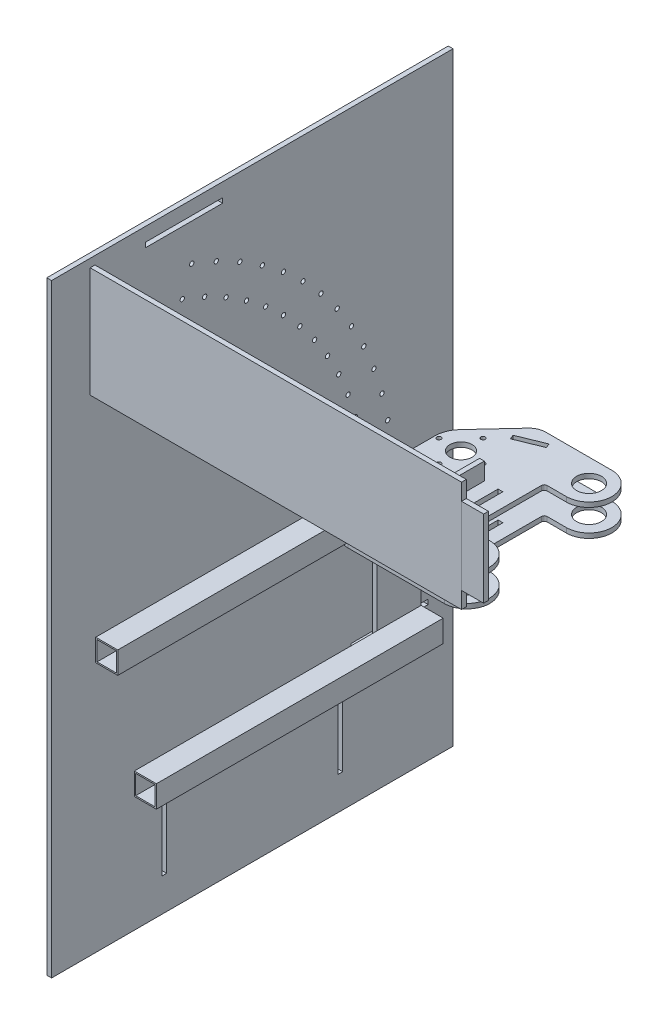
from build123d import *

# Parameters (mm, degrees)
CROQUIS3_R                   = 2.4892
CROQUIS3_R_2                 = 12.7
CROQUIS3_R_3                 = 26.19375
CROQUIS3_R_4                 = 14.2875
SALIENTE_EXTRUIR1_DEPTH      = 5.5
SALIENTE_EXTRUIR2_START      = -25.4
CROQUIS4_R                   = 14.2875
SALIENTE_EXTRUIR2_DEPTH      = 5.5
SALIENTE_EXTRUIR5_DEPTH      = 330.2
SALIENTE_EXTRUIR5_DEPTH_BACK = 30.325
CROQUIS7_W                   = 25.4
CROQUIS7_H                   = 25.4
CROQUIS7_W_2                 = 22.225
CROQUIS7_H_2                 = 22.225
SALIENTE_EXTRUIR6_START      = -80.264
CROQUIS8_W                   = 25.4
CROQUIS8_H                   = 265.106252616
CROQUIS8_H_2                 = 65.093747384
SALIENTE_EXTRUIR6_DEPTH      = 25.4
VACIADO1_T                   = -1.5875
CROQUIS9_W                   = 5.5
CROQUIS9_H                   = 31.75
CORTAR_EXTRUIR1_DEPTH        = 5.5
SALIENTE_EXTRUIR7_START      = -5.5
CROQUIS9_3_W                 = 5.5
CROQUIS9_3_H                 = 31.75
SALIENTE_EXTRUIR7_DEPTH      = 19.05
SALIENTE_EXTRUIR8_START      = -5.5
CROQUIS9_4_W                 = 5.5
CROQUIS9_4_H                 = 9.525
CROQUIS9_4_H_2               = 31.75
SALIENTE_EXTRUIR8_DEPTH      = 105.664
CROQUIS10_W                  = 5.5
CROQUIS10_H                  = 31.75
CORTAR_EXTRUIR2_DEPTH        = 125.476
REDONDEO1_R                  = 2.54
SALIENTE_EXTRUIR9_START      = 5.5
CROQUIS10_4_W                = 5.5
CROQUIS10_4_H                = 31.75
SALIENTE_EXTRUIR9_DEPTH      = 25.4
SALIENTE_EXTRUIR10_START     = 5.5
CROQUIS10_5_W                = 5.5
CROQUIS10_5_H                = 50.8
SALIENTE_EXTRUIR10_DEPTH     = 25.4
SALIENTE_EXTRUIR11_START     = 30.9
CROQUIS10_7_W                = 5.5
CROQUIS10_7_H                = 31.75
SALIENTE_EXTRUIR11_DEPTH     = 25.4
CROQUIS11_W                  = 462.125
CROQUIS11_H                  = 695.364
CROQUIS11_R                  = 2.4892
SALIENTE_EXTRUIR15_DEPTH     = 5.5
CROQUIS13_W                  = 5.5
CROQUIS13_H                  = 88.9
CROQUIS13_W_2                = 88.9
CROQUIS13_H_2                = 5.5
CORTAR_EXTRUIR4_DEPTH        = 5.5
SALIENTE_EXTRUIR16_START     = -5.5
CROQUIS13_3_W                = 5.5
CROQUIS13_3_H                = 88.9
SALIENTE_EXTRUIR16_DEPTH     = 25.4
SALIENTE_EXTRUIR17_START     = -5.5
CROQUIS13_5_W                = 5.5
CROQUIS13_5_H                = 127
SALIENTE_EXTRUIR17_DEPTH     = 427.482
SALIENTE_EXTRUIR18_START     = -432.982
CROQUIS13_6_W                = 5.5
CROQUIS13_6_H                = 88.9
SALIENTE_EXTRUIR18_DEPTH     = 25.4
CROQUIS14_R                  = 2.4892
CORTAR_EXTRUIR5_DEPTH        = 590.160895234


with BuildPart() as part:
    # Croquis3 → Saliente-Extruir1 (new body)
    # profile 1 of 4: a face of its own
    with BuildSketch(Plane(origin=(0, 0, 0), x_dir=(1, 0, 0), z_dir=(0, 1, 0))):
        with BuildLine():
            ThreePointArc((-69.85, 75.40625), (-96.04375, 101.6), (-69.85, 127.79375))
            Line((-69.85, 127.79375), (-146.05, 127.79375))
            ThreePointArc((-146.05, 127.79375), (-153.672023606, 126.202480084), (-160.020693211, 121.6945118))
            Line((-160.020693211, 121.6945118), (-198.003950242, 80.719900472))
            ThreePointArc((-198.003950242, 80.719900472), (-165.049154863, 88.253773247), (-146.002858571, 60.325))
            ThreePointArc((-146.002858571, 60.325), (-176.002858571, 30.325), (-206.002858571, 60.325))
            Line((-206.002858571, 60.325), (-206.002858571, -39.693747384))
            ThreePointArc((-206.002858571, -39.693747384), (-198.563370813, -57.654259626), (-180.602858571, -65.093747384))
            Line((-180.602858571, -65.093747384), (-69.85, -65.093747384))
            ThreePointArc((-69.85, -65.093747384), (-96.04375, -38.899997384), (-69.85, -12.706247384))
            Line((-69.85, -12.706247384), (-92.075, -12.706247384))
            ThreePointArc((-92.075, -12.706247384), (-94.32006403, -11.776311414), (-95.25, -9.531247384))
            Line((-95.25, -9.531247384), (-95.25, 72.23125))
            ThreePointArc((-95.25, 72.23125), (-94.32006403, 74.47631403), (-92.075, 75.40625))
            Line((-92.075, 75.40625), (-69.85, 75.40625))
        make_face()
    # profile 2 of 4: a face of its own
    with BuildSketch(Plane(origin=(0, 0, 0), x_dir=(1, 0, 0), z_dir=(0, 1, 0))):
        with BuildLine():
            ThreePointArc((-146.002858571, 60.325), (-165.049154863, 88.253773247), (-198.003950242, 80.719900472))
            ThreePointArc((-198.003950242, 80.719900472), (-203.931631818, 71.278703708), (-206.002858571, 60.325))
            ThreePointArc((-206.002858571, 60.325), (-176.002858571, 30.325), (-146.002858571, 60.325))
        make_face()
        with Locations(Location((-176.002858571, 34.925, 0), (0, 0, 270))):
            Circle(CROQUIS3_R, mode=Mode.SUBTRACT)
        with Locations(Location((-201.402858571, 60.325, 0), (0, 0, 270))):
            Circle(CROQUIS3_R, mode=Mode.SUBTRACT)
        with Locations(Location((-176.002858571, 60.325, 0), (0, 0, 270))):
            Circle(CROQUIS3_R_2, mode=Mode.SUBTRACT)
        with Locations(Location((-150.602858571, 60.325, 0), (0, 0, 270))):
            Circle(CROQUIS3_R, mode=Mode.SUBTRACT)
        with Locations(Location((-176.002858571, 85.725, 0), (0, 0, 270))):
            Circle(CROQUIS3_R, mode=Mode.SUBTRACT)
    # profile 3 of 4: a face of its own
    with BuildSketch(Plane(origin=(0, 0, 0), x_dir=(1, 0, 0), z_dir=(0, 1, 0))):
        with Locations((-69.85, 101.6)):
            Circle(CROQUIS3_R_3)
        with Locations(Location((-69.85, 101.6, 0), (0, 0, 270))):
            Circle(CROQUIS3_R_4, mode=Mode.SUBTRACT)
    # profile 4 of 4: a face of its own
    with BuildSketch(Plane(origin=(0, 0, 0), x_dir=(1, 0, 0), z_dir=(0, 1, 0))):
        with Locations((-69.85, -38.899997384)):
            Circle(CROQUIS3_R_3)
        with Locations(Location((-69.85, -38.899997384, 0), (0, 0, 270))):
            Circle(CROQUIS3_R_4, mode=Mode.SUBTRACT)
    extrude(amount=SALIENTE_EXTRUIR1_DEPTH)


with BuildPart() as body_2:
    # Croquis4 → Saliente-Extruir2 (new body)
    with BuildSketch(Plane(origin=(0, 0, 0), x_dir=(1, 0, 0), z_dir=(0, 1, 0)).offset(SALIENTE_EXTRUIR2_START)):
        with BuildLine():
            ThreePointArc((-146.002858571, 60.325), (-154.789655135, 39.111796564), (-176.002858571, 30.325))
            Line((-176.002858571, 30.325), (-199.652858571, 30.325))
            ThreePointArc((-199.652858571, 30.325), (-204.142986631, 28.465128061), (-206.002858571, 23.975))
            Line((-206.002858571, 23.975), (-206.002858571, -39.693747384))
            ThreePointArc((-206.002858571, -39.693747384), (-198.563370813, -57.654259626), (-180.602858571, -65.093747384))
            Line((-180.602858571, -65.093747384), (-69.85, -65.093747384))
            ThreePointArc((-69.85, -65.093747384), (-43.65625, -38.899997384), (-69.85, -12.706247384))
            Line((-69.85, -12.706247384), (-92.075, -12.706247384))
            ThreePointArc((-92.075, -12.706247384), (-94.32006403, -11.776311414), (-95.25, -9.531247384))
            Line((-95.25, -9.531247384), (-95.25, 72.23125))
            ThreePointArc((-95.25, 72.23125), (-94.32006403, 74.47631403), (-92.075, 75.40625))
            Line((-92.075, 75.40625), (-69.85, 75.40625))
            ThreePointArc((-69.85, 75.40625), (-43.65625, 101.6), (-69.85, 127.79375))
            Line((-69.85, 127.79375), (-146.05, 127.79375))
            ThreePointArc((-146.05, 127.79375), (-153.672023606, 126.202480084), (-160.020693211, 121.6945118))
            Line((-160.020693211, 121.6945118), (-198.003950242, 80.719900472))
            ThreePointArc((-198.003950242, 80.719900472), (-165.049154863, 88.253773247), (-146.002858571, 60.325))
        make_face()
        with Locations(Location((-69.85, -38.899997384, 0), (0, 0, 90))):
            Circle(CROQUIS4_R, mode=Mode.SUBTRACT)
        with Locations(Location((-69.85, 101.6, 0), (0, 0, 90))):
            Circle(CROQUIS4_R, mode=Mode.SUBTRACT)
    extrude(amount=-SALIENTE_EXTRUIR2_DEPTH)

    # Croquis9 → Cortar-Extruir1 (cut)
    with BuildSketch(Plane(origin=(0, -25.4, 0), x_dir=(1, 0, 0), z_dir=(0, 1, 0))):
        with Locations((-164.302858571, -25.4)):
            Rectangle(CROQUIS9_W, CROQUIS9_H)
        with Locations((-133.402858571, -25.4)):
            Rectangle(CROQUIS9_W, CROQUIS9_H)
    extrude(amount=-CORTAR_EXTRUIR1_DEPTH, mode=Mode.SUBTRACT)


with BuildPart() as body_3:
    # Croquis7 → Saliente-Extruir5 (new, two sides: drawn at the far end of the back side and taken through both)
    with BuildSketch(Plane.XY.offset(-SALIENTE_EXTRUIR5_DEPTH_BACK)):
        with Locations((-193.302858571, -12.7)):
            Rectangle(CROQUIS7_W, CROQUIS7_H)
        with Locations((-193.302858571, -12.7)):
            Rectangle(CROQUIS7_W_2, CROQUIS7_H_2, mode=Mode.SUBTRACT)
    extrude(amount=SALIENTE_EXTRUIR5_DEPTH + SALIENTE_EXTRUIR5_DEPTH_BACK)


with BuildPart() as body_4:
    # Croquis8 → Saliente-Extruir6 (new body)
    with BuildSketch(Plane(origin=(0, -30.9, 0), x_dir=(1, 0, 0), z_dir=(0, 1, 0)).offset(SALIENTE_EXTRUIR6_START)):
        with Locations((-148.852858571, -197.646873692)):
            Rectangle(CROQUIS8_W, CROQUIS8_H)
        with Locations((-148.852858571, -32.546873692)):
            Rectangle(CROQUIS8_W, CROQUIS8_H_2)
    extrude(amount=-SALIENTE_EXTRUIR6_DEPTH)

    # Vaciado1
    vaciado1_openings = [body_4.faces().sort_by_distance(p)[0] for p in [
        (-148.852858571, -123.864, 330.2),
        (-148.852858571, -123.864, 0),
    ]]
    offset(amount=VACIADO1_T, openings=vaciado1_openings, kind=Kind.INTERSECTION)


with BuildPart() as body_5:
    # Croquis9<3> → Saliente-Extruir7 (new body)
    with BuildSketch(Plane(origin=(0, -25.4, 0), x_dir=(1, 0, 0), z_dir=(0, 1, 0)).offset(SALIENTE_EXTRUIR7_START)):
        with Locations((-164.302858571, -25.4)):
            Rectangle(CROQUIS9_3_W, CROQUIS9_3_H)
    extrude(amount=SALIENTE_EXTRUIR7_DEPTH)


with BuildPart() as body_6:
    # Croquis9<4> → Saliente-Extruir8 (new body)
    with BuildSketch(Plane(origin=(0, -25.4, 0), x_dir=(1, 0, 0), z_dir=(0, 1, 0)).offset(SALIENTE_EXTRUIR8_START)):
        with Locations((-164.302858571, -46.0375)):
            Rectangle(CROQUIS9_4_W, CROQUIS9_4_H)
        with Locations((-164.302858571, -25.4)):
            Rectangle(CROQUIS9_4_W, CROQUIS9_4_H_2)
        with Locations((-164.302858571, -4.7625)):
            Rectangle(CROQUIS9_4_W, CROQUIS9_4_H)
    extrude(amount=-SALIENTE_EXTRUIR8_DEPTH)


with BuildPart() as cortar_extruir2_tool:
    # Croquis10 → Cortar-Extruir2 (new body)
    with BuildSketch(Plane(origin=(0, -30.9, 0), x_dir=(1, 0, 0), z_dir=(0, 1, 0))):
        Polygon((-132.265114716, 117.849490196), (-161.667858629, 105.868624183), (-159.59243302, 100.775235474), (-130.189689108, 112.756101487), align=None)
        with Locations((-135.25, 27.78125)):
            Rectangle(CROQUIS10_W, CROQUIS10_H)
        with Locations((-113.875, 27.78125)):
            Rectangle(CROQUIS10_W, CROQUIS10_H)
        with Locations((-148.852858571, -25.4)):
            Rectangle(CROQUIS10_W, CROQUIS10_H)
    extrude(amount=CORTAR_EXTRUIR2_DEPTH)


with BuildPart() as part_1:
    add(part.part)

    # Cortar-Extruir2: cut by cortar_extruir2_tool
    add(cortar_extruir2_tool.part, mode=Mode.SUBTRACT)


with BuildPart() as body_2_1:
    add(body_2.part)

    # Cortar-Extruir2: cut by cortar_extruir2_tool
    add(cortar_extruir2_tool.part, mode=Mode.SUBTRACT)

    # Redondeo1
    redondeo1_edges = [body_2_1.edges().sort_by_distance(p)[0] for p in [
        (-198.003950242, -28.15, -80.719900472),
    ]]
    fillet(redondeo1_edges, radius=REDONDEO1_R)


with BuildPart() as body_7:
    # Croquis10<4> → Saliente-Extruir9 (new body)
    with BuildSketch(Plane(origin=(0, -30.9, 0), x_dir=(1, 0, 0), z_dir=(0, 1, 0)).offset(SALIENTE_EXTRUIR9_START)):
        with Locations((-135.25, 27.78125)):
            Rectangle(CROQUIS10_4_W, CROQUIS10_4_H)
    extrude(amount=-SALIENTE_EXTRUIR9_DEPTH)


with BuildPart() as body_8:
    # Croquis10<5> → Saliente-Extruir10 (new body)
    with BuildSketch(Plane(origin=(0, -30.9, 0), x_dir=(1, 0, 0), z_dir=(0, 1, 0)).offset(SALIENTE_EXTRUIR10_START)):
        with Locations((-135.25, 27.78125)):
            Rectangle(CROQUIS10_5_W, CROQUIS10_5_H)
    extrude(amount=SALIENTE_EXTRUIR10_DEPTH)


with BuildPart() as body_9:
    # Croquis10<7> → Saliente-Extruir11 (new body)
    with BuildSketch(Plane(origin=(0, -30.9, 0), x_dir=(1, 0, 0), z_dir=(0, 1, 0)).offset(SALIENTE_EXTRUIR11_START)):
        with Locations((-135.25, 27.78125)):
            Rectangle(CROQUIS10_7_W, CROQUIS10_7_H)
    extrude(amount=SALIENTE_EXTRUIR11_DEPTH)


with BuildPart() as body_10:
    # Croquis11 → Saliente-Extruir15 (new body)
    with BuildSketch(Plane.ZY.offset(206.002858571)):
        with Locations((149.9375, 33.318)):
            Rectangle(CROQUIS11_W, CROQUIS11_H)
        with Locations((-11.275, -12.7)):
            Circle(CROQUIS11_R, mode=Mode.SUBTRACT)
        with Locations((20.475, -12.7)):
            Circle(CROQUIS11_R, mode=Mode.SUBTRACT)
        with Locations((298.45, -12.7)):
            Circle(CROQUIS11_R, mode=Mode.SUBTRACT)
        with Locations((-9.93933903, 17.891665704)):
            Circle(CROQUIS11_R, mode=Mode.SUBTRACT)
        with Locations((21.689842634, 15.124470872)):
            Circle(CROQUIS11_R, mode=Mode.SUBTRACT)
        with Locations((-5.942521307, 48.250510361)):
            Circle(CROQUIS11_R, mode=Mode.SUBTRACT)
        with Locations((25.325124851, 42.73718072)):
            Circle(CROQUIS11_R, mode=Mode.SUBTRACT)
        with Locations((0.685034973, 78.145484831)):
            Circle(CROQUIS11_R, mode=Mode.SUBTRACT)
        with Locations((31.353179957, 69.927980149)):
            Circle(CROQUIS11_R, mode=Mode.SUBTRACT)
        with Locations((9.892890104, 107.349070307)):
            Circle(CROQUIS11_R, mode=Mode.SUBTRACT)
        with Locations((39.728130814, 96.489930757)):
            Circle(CROQUIS11_R, mode=Mode.SUBTRACT)
        with Locations((21.61096675, 135.639009871)):
            Circle(CROQUIS11_R, mode=Mode.SUBTRACT)
        with Locations((50.386238989, 122.220880061)):
            Circle(CROQUIS11_R, mode=Mode.SUBTRACT)
        with Locations((35.750083272, 162.8)):
            Circle(CROQUIS11_R, mode=Mode.SUBTRACT)
        with Locations((63.246389842, 146.925)):
            Circle(CROQUIS11_R, mode=Mode.SUBTRACT)
        with Locations((52.202632455, 188.625329159)):
            Circle(CROQUIS11_R, mode=Mode.SUBTRACT)
        with Locations((78.210709861, 170.414277305)):
            Circle(CROQUIS11_R, mode=Mode.SUBTRACT)
        with Locations((70.843400465, 212.918451)):
            Circle(CROQUIS11_R, mode=Mode.SUBTRACT)
        with Locations((95.165311534, 192.509944392)):
            Circle(CROQUIS11_R, mode=Mode.SUBTRACT)
        with Locations((91.530519804, 235.494480196)):
            Circle(CROQUIS11_R, mode=Mode.SUBTRACT)
        with Locations((113.981160106, 213.043839894)):
            Circle(CROQUIS11_R, mode=Mode.SUBTRACT)
        with Locations((114.106549, 256.181599535)):
            Circle(CROQUIS11_R, mode=Mode.SUBTRACT)
        with Locations((134.515055608, 231.859688466)):
            Circle(CROQUIS11_R, mode=Mode.SUBTRACT)
        with Locations((138.399670841, 274.822367545)):
            Circle(CROQUIS11_R, mode=Mode.SUBTRACT)
        with Locations((156.610722695, 248.814290139)):
            Circle(CROQUIS11_R, mode=Mode.SUBTRACT)
        with Locations((164.225, 291.274916728)):
            Circle(CROQUIS11_R, mode=Mode.SUBTRACT)
        with Locations((180.1, 263.778610158)):
            Circle(CROQUIS11_R, mode=Mode.SUBTRACT)
        with Locations((191.385990129, 305.41403325)):
            Circle(CROQUIS11_R, mode=Mode.SUBTRACT)
        with Locations((204.804119939, 276.638761011)):
            Circle(CROQUIS11_R, mode=Mode.SUBTRACT)
        with Locations((219.675929693, 317.132109896)):
            Circle(CROQUIS11_R, mode=Mode.SUBTRACT)
        with Locations((230.535069243, 287.296869186)):
            Circle(CROQUIS11_R, mode=Mode.SUBTRACT)
    extrude(amount=SALIENTE_EXTRUIR15_DEPTH)

    # Croquis13 → Cortar-Extruir4 (cut)
    with BuildSketch(Plane.ZY.offset(211.502858571)):
        with Locations((333.8, 307.975)):
            Rectangle(CROQUIS13_W, CROQUIS13_H)
        with Locations((228.6, 362.375)):
            Rectangle(CROQUIS13_W_2, CROQUIS13_H_2)
        with Locations((251.25, -231.814)):
            Rectangle(CROQUIS13_W, CROQUIS13_H)
        with Locations((48.625, -231.814)):
            Rectangle(CROQUIS13_W, CROQUIS13_H)
        with Locations((-8.1, -156.039)):
            Rectangle(CROQUIS13_W_2, CROQUIS13_H_2)
    extrude(amount=-CORTAR_EXTRUIR4_DEPTH, mode=Mode.SUBTRACT)


with BuildPart() as body_11:
    # Croquis13<3> → Saliente-Extruir16 (new body)
    with BuildSketch(Plane.ZY.offset(211.502858571).offset(SALIENTE_EXTRUIR16_START)):
        with Locations((333.8, 307.975)):
            Rectangle(CROQUIS13_3_W, CROQUIS13_3_H)
    extrude(amount=SALIENTE_EXTRUIR16_DEPTH)


with BuildPart() as body_12:
    # Croquis13<5> → Saliente-Extruir17 (new body)
    with BuildSketch(Plane.ZY.offset(211.502858571).offset(SALIENTE_EXTRUIR17_START)):
        with Locations((333.8, 307.975)):
            Rectangle(CROQUIS13_5_W, CROQUIS13_5_H)
    extrude(amount=-SALIENTE_EXTRUIR17_DEPTH)


with BuildPart() as body_13:
    # Croquis13<6> → Saliente-Extruir18 (new body)
    with BuildSketch(Plane.ZY.offset(211.502858571).offset(SALIENTE_EXTRUIR18_START)):
        with Locations((333.8, 307.975)):
            Rectangle(CROQUIS13_6_W, CROQUIS13_6_H)
    extrude(amount=-SALIENTE_EXTRUIR18_DEPTH)


with BuildPart() as cortar_extruir5_tool:
    # Croquis14 → Cortar-Extruir5 (new, through all)
    with BuildSketch(Plane(origin=(0, 5.5, 0), x_dir=(1, 0, 0), z_dir=(0, 1, 0))):
        with Locations(Location((-193.302858571, -46.043747384, 0), (0, 0, 180))):
            Circle(CROQUIS14_R)
        with Locations(Location((-193.302858571, -33.343747384, 0), (0, 0, 180))):
            Circle(CROQUIS14_R)
        with Locations(Location((-193.302858571, -7.943747384, 0), (0, 0, 180))):
            Circle(CROQUIS14_R)
        with Locations(Location((-193.302858571, 17.456252616, 0), (0, 0, 180))):
            Circle(CROQUIS14_R)
    extrude(amount=-CORTAR_EXTRUIR5_DEPTH)


with BuildPart() as part_2:
    add(part_1.part)

    # Cortar-Extruir5: cut by cortar_extruir5_tool
    add(cortar_extruir5_tool.part, mode=Mode.SUBTRACT)


with BuildPart() as body_2_2:
    add(body_2_1.part)

    # Cortar-Extruir5: cut by cortar_extruir5_tool
    add(cortar_extruir5_tool.part, mode=Mode.SUBTRACT)


with BuildPart() as body_3_1:
    add(body_3.part)

    # Cortar-Extruir5: cut by cortar_extruir5_tool
    add(cortar_extruir5_tool.part, mode=Mode.SUBTRACT)


solid = Compound([body_4.part, body_5.part, body_6.part, body_7.part, body_8.part, body_9.part, body_10.part, body_11.part, body_12.part, body_13.part, part_2.part, body_2_2.part, body_3_1.part])
